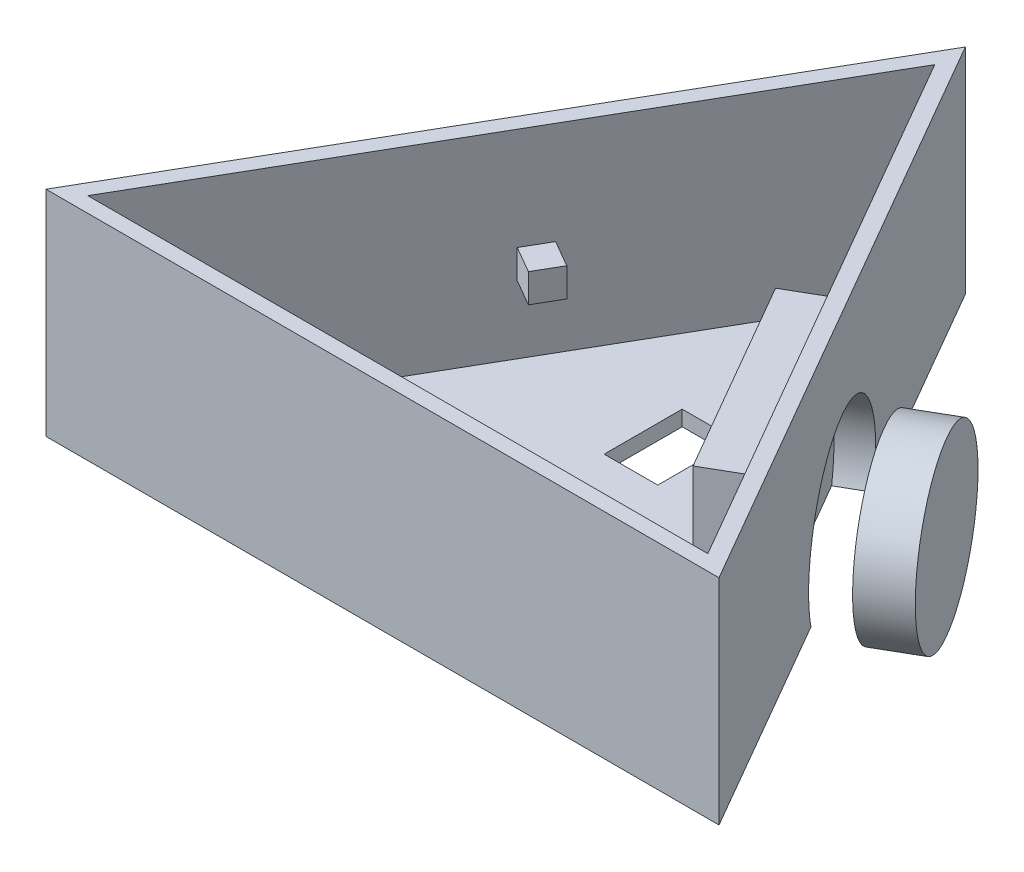
from build123d import *

# Parameters (mm, degrees)
BOSS_EXTRUDE1_DEPTH = 70
CUT_EXTRUDE1_DEPTH  = 65
SKETCH3_R           = 28
BOSS_EXTRUDE2_DEPTH = 15
SKETCH4_R           = 2
CUT_EXTRUDE2_DEPTH  = 65
SKETCH5_W           = 17.517791656
SKETCH5_H           = 25.498705067
CUT_EXTRUDE3_DEPTH  = 65
SKETCH6_W           = 9.177614019
SKETCH6_H           = 9.406934548
BOSS_EXTRUDE3_DEPTH = 10
BOSS_EXTRUDE4_DEPTH = 45
SKETCH7_R           = 30
CUT_EXTRUDE4_DEPTH  = 10


with BuildPart() as part:
    # Sketch1 → Boss-Extrude1 (new body)
    with BuildSketch(Plane(origin=(0, 0, 0), x_dir=(1, 0, 0), z_dir=(0, 1, 0))):
        Polygon((110, 0), (-110, 0), (0, 190.525588833), align=None)
    extrude(amount=BOSS_EXTRUDE1_DEPTH)

    # Sketch2 → Cut-Extrude1 (cut)
    with BuildSketch(Plane(origin=(0, 70, 0), x_dir=(1, 0, 0), z_dir=(0, 1, 0))):
        Polygon((-101.339745962, 5), (101.339745962, 5), (0, 180.525588833), align=None)
    extrude(amount=-CUT_EXTRUDE1_DEPTH, mode=Mode.SUBTRACT)

    # Sketch4 → Cut-Extrude2 (cut)
    with BuildSketch(Plane(origin=(82.5, 0, -47.631397208), x_dir=(-0.5, 0, -0.8660254037844386), z_dir=(0.8660254037844387, 0, -0.5000000000000001))):
        with Locations((55, 11)):
            Circle(SKETCH4_R)
    extrude(amount=-CUT_EXTRUDE2_DEPTH, mode=Mode.SUBTRACT)

    # Sketch5 → Cut-Extrude3 (cut)
    with BuildSketch(Plane(origin=(0, 5, 0), x_dir=(1, 0, 0), z_dir=(0, 1, 0))):
        with Locations((0, 93.96640493)):
            Rectangle(SKETCH5_W, SKETCH5_H)
    extrude(amount=-CUT_EXTRUDE3_DEPTH, mode=Mode.SUBTRACT)

    # Sketch6 → Boss-Extrude3 (add)
    with BuildSketch(Plane(origin=(-78.169872981, 0, -45.131397208), x_dir=(0.49999999999999983, 0, -0.8660254037844387), z_dir=(0.8660254037844387, 0, 0.49999999999999983))):
        with Locations((61.014752259, 31.810852178)):
            Rectangle(SKETCH6_W, SKETCH6_H)
    extrude(amount=BOSS_EXTRUDE3_DEPTH)

    # Sketch8 → Boss-Extrude4 (add)
    with BuildSketch(Plane(origin=(0, 5, 0), x_dir=(1, 0, 0), z_dir=(0, 1, 0))):
        Polygon((71.169539548, 57.256330384), (34.325297845, 121.07242898), (17.256316286, 111.217647881), (54.100557988, 47.401549286), align=None)
    extrude(amount=BOSS_EXTRUDE4_DEPTH)

    # Sketch7 → Cut-Extrude4 (cut)
    with BuildSketch(Plane(origin=(82.5, 0, -47.631397208), x_dir=(-0.5, 0, -0.8660254037844386), z_dir=(0.8660254037844387, 0, -0.5000000000000001))):
        with Locations((55, 11)):
            Circle(SKETCH7_R)
    extrude(amount=-CUT_EXTRUDE4_DEPTH, mode=Mode.SUBTRACT)


with BuildPart() as body_2:
    # Sketch3 → Boss-Extrude2 (new body)
    with BuildSketch(Plane(origin=(91.160254038, 0, -52.631397208), x_dir=(-0.5, 0, -0.8660254037844386), z_dir=(0.8660254037844387, 0, -0.5000000000000001))):
        with Locations((55, 11)):
            Circle(SKETCH3_R)
    extrude(amount=BOSS_EXTRUDE2_DEPTH)


solid = Compound([part.part, body_2.part])
